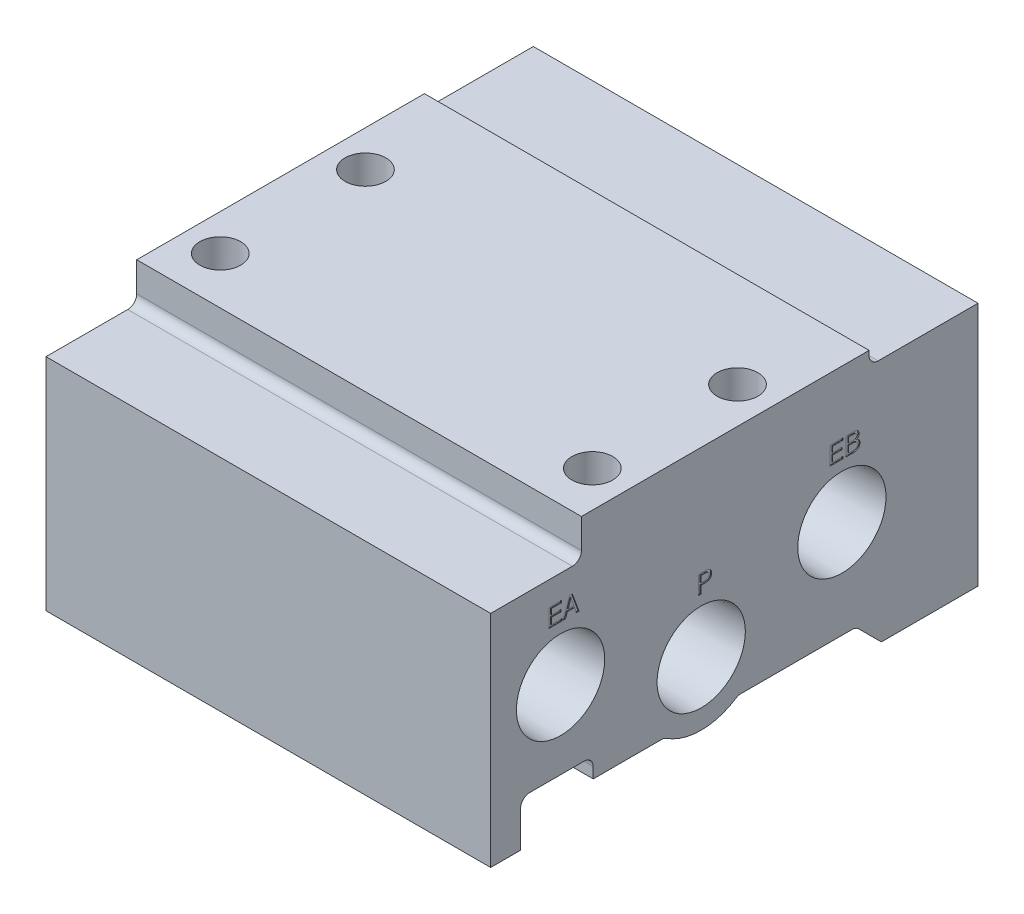
from build123d import *

# Parameters (mm, degrees)
ALUM_EXT_SKETCH_W          = 53.7
ALUM_EXT_SKETCH_H          = 28.5
ALUM_EXT_DEPTH             = 49
MGT_HOLES_SKETCH_R         = 2.25
MGT_HOLES_DEPTH            = 63.722982231
TOP_PROFILE_41_SKETCH_W    = 10
TOP_PROFILE_41_SKETCH_H    = 4.25
TOP_PROFILE_41_SKETCH_W_2  = 12
TOP_PROFILE_41_SKETCH_H_2  = 1.5
TOP_PROFILE_41_DEPTH       = 63.722982231
BOTTOM_PROFILE_41_DEPTH    = 63.722982231
ROUNDS_41_R                = 1
PORTS_AT_2_COUNT           = 2
PORTS_AT_2_PITCH           = 16.317475295
PORTS_AT_3_COUNT           = 2
PORTS_AT_3_PITCH           = 16.317475295
PORTS_MIRROR_AT_2_COUNT    = 2
PORTS_MIRROR_AT_2_PITCH    = 16.317475295
PORTS_MIRROR_AT_3_COUNT    = 2
PORTS_MIRROR_AT_3_PITCH    = 31
F_41_42_PORT_LABELS1_DEPTH = 0.1
F_41_42_PORT_LABELS2_DEPTH = 0.1
F_41_42_A_B_LABELS_DEPTH   = 0.1


with BuildPart() as part:
    # Alum Ext Sketch → Alum Ext (new body)
    with BuildSketch(Plane(origin=(0, 0, 0), x_dir=(0, 0, -1), z_dir=(1, 0, 0))):
        with Locations((0, -14.25)):
            Rectangle(ALUM_EXT_SKETCH_W, ALUM_EXT_SKETCH_H)
    extrude(amount=-ALUM_EXT_DEPTH)

    # MGT_Holes Sketch → MGT_Holes (cut, through all)
    with BuildSketch(Plane(origin=(0, 0, 0), x_dir=(1, 0, 0), z_dir=(0, 1, 0))):
        with Locations(Location((-45, 4.35, 0), (0, 0, 270))):
            Circle(MGT_HOLES_SKETCH_R)
        with Locations(Location((-45, -11.65, 0), (0, 0, 90))):
            Circle(MGT_HOLES_SKETCH_R)
        with Locations(Location((-4, 4.35, 0), (0, 0, 270))):
            Circle(MGT_HOLES_SKETCH_R)
        with Locations(Location((-4, -11.65, 0), (0, 0, 270))):
            Circle(MGT_HOLES_SKETCH_R)
    extrude(amount=-MGT_HOLES_DEPTH, mode=Mode.SUBTRACT)

    # Top_Profile_41 Sketch → Top_Profile_41 (cut, through all)
    with BuildSketch(Plane(origin=(0, 0, 0), x_dir=(0, 0, -1), z_dir=(1, 0, 0))):
        with Locations((-21.85, -2.125)):
            Rectangle(TOP_PROFILE_41_SKETCH_W, TOP_PROFILE_41_SKETCH_H)
        with Locations((20.85, -0.75)):
            Rectangle(TOP_PROFILE_41_SKETCH_W_2, TOP_PROFILE_41_SKETCH_H_2)
    extrude(amount=-TOP_PROFILE_41_DEPTH, mode=Mode.SUBTRACT)

    # Bottom_Profile_41 Sketch → Bottom_Profile_41 (cut, through all)
    with BuildSketch(Plane(origin=(0, 0, 0), x_dir=(0, 0, -1), z_dir=(1, 0, 0))):
        with BuildLine():
            Line((16.2, -28.5), (13.4, -25.7))
            Line((13.4, -25.7), (0.413249931, -25.7))
            ThreePointArc((0.413249931, -25.7), (-3.65, -27), (-7.713249931, -25.7))
            Line((-7.713249931, -25.7), (-15.55, -25.7))
            Line((-15.55, -25.7), (-15.55, -23.5))
            Line((-15.55, -23.5), (-23.55, -23.5))
            Line((-23.55, -23.5), (-23.55, -28.5))
            Line((-23.55, -28.5), (16.2, -28.5))
        make_face()
    extrude(amount=-BOTTOM_PROFILE_41_DEPTH, mode=Mode.SUBTRACT)

    # Rounds_41
    rounds_41_edges = [part.edges().sort_by_distance(p)[0] for p in [
        (-24.5, -4.25, 16.85),
        (-24.5, -1.5, -14.85),
        (-24.5, -25.7, -0.413249931),
        (-24.5, -23.5, 23.55),
        (-24.5, -23.5, 15.55),
        (-24.5, -25.7, 7.713249931),
        (-24.5, -25.7, -13.4),
    ]]
    fillet(rounds_41_edges, radius=ROUNDS_41_R)

    # Ports Profile Sketch → Ports (revolve, cut)
    with BuildSketch(Plane(origin=(0, -20, 3.65), x_dir=(0, 0, -1), z_dir=(0, 1, 0))):
        Polygon((0, 0), (0, 22.45), (3.95, 18.5), (3.95, 7.4), (4.632997004, 7.4), (4.864, 0), align=None)
    ports = revolve(axis=Axis((6.35, -20, 3.65), (-1, 0, 0)), mode=Mode.SUBTRACT)

    # Ports at 2: Ports ×2
    with Locations(*[Vector(0, 0.31254835125081226, -0.9499018518407041) * (i * PORTS_AT_2_PITCH) for i in range(1, PORTS_AT_2_COUNT)]):
        add(ports, mode=Mode.SUBTRACT)

    # Ports at 3: Ports ×2
    with Locations(*[Vector(0, 0.31254835125081226, 0.9499018518407041) * (i * PORTS_AT_3_PITCH) for i in range(1, PORTS_AT_3_COUNT)]):
        add(ports, mode=Mode.SUBTRACT)

    # Ports Mirror Profile Sketch → Ports Mirror (revolve, cut)
    with BuildSketch(Plane(origin=(-49, -14.9, -11.85), x_dir=(0, 0, 1), z_dir=(0, 1, 0))):
        Polygon((0, 0), (0, 15.885), (3.95, 11.935), (3.95, 7.4), (4.632997004, 7.4), (4.864, 0), align=None)
    ports_mirror = revolve(axis=Axis((-55.35, -14.9, -11.85), (1, 0, 0)), mode=Mode.SUBTRACT)

    # Ports Mirror at 2: Ports Mirror ×2
    with Locations(*[Vector(0, -0.31254835125081226, 0.9499018518407041) * (i * PORTS_MIRROR_AT_2_PITCH) for i in range(1, PORTS_MIRROR_AT_2_COUNT)]):
        add(ports_mirror, mode=Mode.SUBTRACT)

    # Ports Mirror at 3: Ports Mirror ×2
    with Locations(*[(0, 0, i * PORTS_MIRROR_AT_3_PITCH) for i in range(1, PORTS_MIRROR_AT_3_COUNT)]):
        add(ports_mirror, mode=Mode.SUBTRACT)

    # 41,42 Port Labels1 Sketch → 41,42 Port Labels1 (cut)
    # profile 1 of 5: a face of its own
    with BuildSketch(Plane.ZY.offset(49)):
        Polygon((-13.144871795, -8.9), (-13.144871795, -6.9), (-11.731410256, -6.9), (-11.731410256, -7.130769231), (-12.862820513, -7.130769231), (-12.862820513, -7.746153846), (-11.817948718, -7.746153846), (-11.817948718, -7.976923077), (-12.862820513, -7.976923077), (-12.862820513, -8.669230769), (-11.708974359, -8.669230769), (-11.708974359, -8.9), align=None)
    # profile 2 of 5: a face of its own
    with BuildSketch(Plane.ZY.offset(49)):
        with BuildLine():
            Line((-11.375641026, -8.9), (-11.375641026, -6.9))
            Line((-11.375641026, -6.9), (-10.582371795, -6.9))
            add(Edge.make_bspline(
                [(-10.582371795, -6.9), (-10.557520601, -6.900391088), (-10.509221677, -6.901151178), (-10.439257463, -6.906808568), (-10.373884128, -6.915794729), (-10.313491954, -6.928977632), (-10.25772712, -6.945607443), (-10.206981233, -6.966644139), (-10.160714162, -6.990826937), (-10.119486132, -7.019131964), (-10.082912178, -7.050918934), (-10.051607199, -7.087006382), (-10.024425363, -7.126312863), (-10.002795087, -7.169699096), (-9.985826511, -7.216613207), (-9.974014126, -7.267309873), (-9.966656438, -7.321659157), (-9.965816477, -7.359110147), (-9.965384615, -7.378365385)],
                knots=[0, 0, 0, 0, 1.338531614, 2.601470082, 3.778553788, 4.890456792, 5.928162005, 6.908738963, 7.84520586, 8.735147048, 9.596633689, 10.447968487, 11.301973765, 12.164180963, 13.051676454, 13.983434255, 14.963192844, 16, 16, 16, 16], degree=3))
            add(Edge.make_bspline(
                [(-9.965384615, -7.378365385), (-9.966331591, -7.402996395), (-9.968168925, -7.450785796), (-9.981718133, -7.519887959), (-10.005663085, -7.582918484), (-10.038410282, -7.640323126), (-10.080645807, -7.691469707), (-10.132507487, -7.735784439), (-10.193110711, -7.77443215), (-10.238424067, -7.793555438), (-10.261858974, -7.803445513)],
                knots=[0, 0, 0, 0, 1.064089938, 2.064560856, 3.027045975, 3.965441717, 4.908263127, 5.877849772, 6.902478258, 8, 8, 8, 8], degree=3))
            add(Edge.make_bspline(
                [(-10.261858974, -7.803445513), (-10.246569522, -7.806518626), (-10.216485798, -7.812565323), (-10.17316555, -7.826052918), (-10.132251748, -7.841956303), (-10.093880076, -7.860736947), (-10.058519403, -7.883036867), (-10.02554128, -7.907811801), (-9.995201163, -7.935720854), (-9.967752142, -7.966578157), (-9.94267115, -7.999705375), (-9.921668464, -8.035541546), (-9.903328698, -8.073092565), (-9.888526343, -8.112963113), (-9.876994446, -8.155075497), (-9.868507088, -8.199259529), (-9.863726514, -8.245513022), (-9.863126284, -8.276992465), (-9.862820513, -8.293028846)],
                knots=[0, 0, 0, 0, 1.079472139, 2.123983387, 3.137357801, 4.117691995, 5.07752268, 6.028353704, 6.970961659, 7.927265266, 8.885490285, 9.843581377, 10.799169054, 11.776706782, 12.784239396, 13.820032524, 14.889472473, 16, 16, 16, 16], degree=3))
            add(Edge.make_bspline(
                [(-9.862820513, -8.293028846), (-9.863272496, -8.315767522), (-9.864153514, -8.360090374), (-9.873541022, -8.424660596), (-9.887061044, -8.485768657), (-9.907353971, -8.543283868), (-9.933566292, -8.597000116), (-9.964872333, -8.647657469), (-10.002489133, -8.694254066), (-10.045355165, -8.737068494), (-10.093055612, -8.775646479), (-10.145401463, -8.808971319), (-10.201906819, -8.836986969), (-10.262136906, -8.860475813), (-10.326816833, -8.877901069), (-10.395416655, -8.890532564), (-10.468116052, -8.898929064), (-10.517977934, -8.899637332), (-10.543509615, -8.9)],
                knots=[0, 0, 0, 0, 1.058427598, 2.063116183, 3.033417234, 3.969927738, 4.896405358, 5.812972495, 6.737861532, 7.679194237, 8.630321786, 9.589794139, 10.563499171, 11.563941868, 12.596215416, 13.678433312, 14.811246201, 16, 16, 16, 16], degree=3))
            Line((-10.543509615, -8.9), (-11.375641026, -8.9))
        make_face()
        with BuildLine():
            Line((-11.093589744, -7.720512821), (-10.638060897, -7.720512821))
            add(Edge.make_bspline(
                [(-10.638060897, -7.720512821), (-10.62189856, -7.72024581), (-10.59060934, -7.719728896), (-10.545208349, -7.716795414), (-10.503095771, -7.710636868), (-10.464283505, -7.702711026), (-10.428663129, -7.693061693), (-10.39684222, -7.679824467), (-10.367793522, -7.665385266), (-10.342235553, -7.64779035), (-10.319629027, -7.628173795), (-10.300015633, -7.605914124), (-10.284162537, -7.580643527), (-10.270210543, -7.55333256), (-10.259923231, -7.523089629), (-10.252860224, -7.490409561), (-10.248348588, -7.45527911), (-10.247747178, -7.430997327), (-10.247435897, -7.418429487)],
                knots=[0, 0, 0, 0, 1.368886017, 2.65007316, 3.849640785, 4.969751217, 6.004381673, 6.968357812, 7.883879336, 8.746530739, 9.588092002, 10.41369514, 11.248159001, 12.107988605, 13.005734059, 13.944160956, 14.935932503, 16, 16, 16, 16], degree=3))
            add(Edge.make_bspline(
                [(-10.247435897, -7.418429487), (-10.24779526, -7.406534873), (-10.248487838, -7.383611119), (-10.252344592, -7.350275069), (-10.259615487, -7.319417291), (-10.2694704, -7.29082689), (-10.28256798, -7.264808482), (-10.298163447, -7.241021057), (-10.316774453, -7.219617856), (-10.338193209, -7.200634591), (-10.362634513, -7.184106045), (-10.389977449, -7.169577213), (-10.420615726, -7.157824898), (-10.454032304, -7.147613488), (-10.490564803, -7.140314754), (-10.529999659, -7.134572338), (-10.572575304, -7.131523238), (-10.60199904, -7.131026383), (-10.617227564, -7.130769231)],
                knots=[0, 0, 0, 0, 1.064043854, 2.05066597, 2.995108535, 3.894129092, 4.74873584, 5.593437176, 6.431611697, 7.277662936, 8.145602371, 9.064553025, 10.040417484, 11.075719197, 12.186014413, 13.368359838, 14.637970495, 16, 16, 16, 16], degree=3))
            Line((-10.617227564, -7.130769231), (-11.093589744, -7.130769231))
            Line((-11.093589744, -7.130769231), (-11.093589744, -7.720512821))
        make_face(mode=Mode.SUBTRACT)
        with BuildLine():
            Line((-11.093589744, -8.669230769), (-10.566746795, -8.669230769))
            add(Edge.make_bspline(
                [(-10.566746795, -8.669230769), (-10.549908372, -8.668922161), (-10.517373227, -8.668325869), (-10.470137599, -8.663774034), (-10.425994956, -8.656854934), (-10.385013028, -8.64634983), (-10.346971081, -8.633180858), (-10.312127837, -8.616877954), (-10.280547117, -8.597345386), (-10.251784041, -8.575352814), (-10.226609275, -8.550046268), (-10.204679995, -8.522071895), (-10.186188284, -8.49137213), (-10.170917321, -8.458069746), (-10.159316799, -8.421991925), (-10.151012013, -8.383343954), (-10.145625468, -8.342058175), (-10.145127121, -8.313612472), (-10.144871795, -8.299038462)],
                knots=[0, 0, 0, 0, 1.261340787, 2.437158505, 3.552412744, 4.605618057, 5.602418951, 6.564726798, 7.481099983, 8.379712099, 9.271165627, 10.147841252, 11.036708081, 11.950072001, 12.886651798, 13.869902527, 14.90865543, 16, 16, 16, 16], degree=3))
            add(Edge.make_bspline(
                [(-10.144871795, -8.299038462), (-10.145117446, -8.284595974), (-10.145594563, -8.256544995), (-10.151054338, -8.215943132), (-10.159140342, -8.17810658), (-10.171288059, -8.143473319), (-10.18652651, -8.111724261), (-10.205588286, -8.083183638), (-10.227647172, -8.057184402), (-10.253710324, -8.034583368), (-10.28331899, -8.01494812), (-10.31638283, -7.997503895), (-10.353598, -7.98333953), (-10.394496601, -7.971081379), (-10.439692519, -7.962804431), (-10.488439021, -7.955798704), (-10.541174333, -7.951838231), (-10.577557944, -7.951471772), (-10.596394231, -7.951282051)],
                knots=[0, 0, 0, 0, 1.058252033, 2.055394168, 2.998523969, 3.890395008, 4.739981298, 5.573732922, 6.40003374, 7.23274972, 8.093659094, 9.000297479, 9.967667442, 11.00874663, 12.12639854, 13.332554366, 14.619027337, 16, 16, 16, 16], degree=3))
            Line((-10.596394231, -7.951282051), (-11.093589744, -7.951282051))
            Line((-11.093589744, -7.951282051), (-11.093589744, -8.669230769))
        make_face(mode=Mode.SUBTRACT)
    # profile 3 of 5: a face of its own
    with BuildSketch(Plane.ZY.offset(49)):
        with BuildLine():
            Line((3.355128205, -14), (3.355128205, -12))
            Line((3.355128205, -12), (4.095913462, -12))
            add(Edge.make_bspline(
                [(4.095913462, -12), (4.12409362, -12.000249378), (4.177002091, -12.000717587), (4.250934098, -12.003608091), (4.314154858, -12.009200397), (4.368073681, -12.016451865), (4.415166702, -12.02754219), (4.458606554, -12.040013914), (4.499344903, -12.056098279), (4.524832794, -12.069234093), (4.537419872, -12.075721154)],
                knots=[0, 0, 0, 0, 1.493455121, 2.803973871, 3.919514338, 4.856337602, 5.683863995, 6.481055044, 7.249876038, 8, 8, 8, 8], degree=3))
            add(Edge.make_bspline(
                [(4.537419872, -12.075721154), (4.557109161, -12.087505308), (4.596238242, -12.110924292), (4.646867088, -12.157428597), (4.691435381, -12.210646113), (4.726929673, -12.2725773), (4.756116688, -12.340350372), (4.776198097, -12.414407034), (4.789029685, -12.493809121), (4.790347685, -12.548692188), (4.791025641, -12.576923077)],
                knots=[0, 0, 0, 0, 0.930560885, 1.849329941, 2.778623248, 3.742228717, 4.739438803, 5.770715934, 6.853295292, 8, 8, 8, 8], degree=3))
            add(Edge.make_bspline(
                [(4.791025641, -12.576923077), (4.790347059, -12.603953612), (4.78902587, -12.65658169), (4.776100386, -12.733053307), (4.755916476, -12.804708226), (4.727367087, -12.871331941), (4.690898401, -12.932063622), (4.64652939, -12.986531524), (4.594678687, -13.034755885), (4.555051994, -13.060899771), (4.535016026, -13.07411859)],
                knots=[0, 0, 0, 0, 1.106237948, 2.15382993, 3.166616047, 4.14912887, 5.113446575, 6.058253874, 7.018218259, 8, 8, 8, 8], degree=3))
            add(Edge.make_bspline(
                [(4.535016026, -13.07411859), (4.522597077, -13.081071894), (4.497311506, -13.095229151), (4.456117103, -13.111618603), (4.412179284, -13.125952788), (4.372704814, -13.134789239), (4.337996409, -13.140616309), (4.307779075, -13.144194947), (4.273668896, -13.146691653), (4.235640761, -13.149761537), (4.193551564, -13.151643471), (4.147467197, -13.152726574), (4.097518693, -13.153554018), (4.06292769, -13.153746548), (4.045032051, -13.153846154)],
                knots=[0, 0, 0, 0, 1.018466528, 2.073646265, 3.168741587, 4.32666575, 4.966710573, 5.68928523, 6.505122404, 7.416327688, 8.421864515, 9.522294478, 10.718160255, 12, 12, 12, 12], degree=3))
            Line((4.045032051, -13.153846154), (3.637179487, -13.153846154))
            Line((3.637179487, -13.153846154), (3.637179487, -14))
            Line((3.637179487, -14), (3.355128205, -14))
        make_face()
        with BuildLine():
            Line((3.637179487, -12.923076923), (4.087900641, -12.923076923))
            add(Edge.make_bspline(
                [(4.087900641, -12.923076923), (4.106734424, -12.922848085), (4.142970313, -12.922407806), (4.195182234, -12.919020543), (4.2428652, -12.912380011), (4.286306282, -12.90452837), (4.324991337, -12.892914993), (4.359724875, -12.880257808), (4.389709515, -12.863882812), (4.415997913, -12.84536947), (4.43829063, -12.823331396), (4.457379289, -12.798065143), (4.473409826, -12.769311124), (4.486624477, -12.737183964), (4.496532941, -12.70151272), (4.503634352, -12.662491291), (4.508057153, -12.619891899), (4.508660905, -12.590288992), (4.508974359, -12.574919872)],
                knots=[0, 0, 0, 0, 1.418142734, 2.728483292, 3.935852239, 5.042182902, 6.047730313, 6.973980857, 7.819836916, 8.612371598, 9.387426252, 10.169752478, 10.989196503, 11.859387264, 12.779284547, 13.771317079, 14.842921177, 16, 16, 16, 16], degree=3))
            add(Edge.make_bspline(
                [(4.508974359, -12.574919872), (4.508621001, -12.560087188), (4.507941592, -12.531568007), (4.504041052, -12.490281163), (4.497103925, -12.452223938), (4.486320171, -12.417522781), (4.473955018, -12.385611284), (4.457636989, -12.357322195), (4.43872536, -12.332221086), (4.416721841, -12.31008833), (4.391039013, -12.291246478), (4.361972539, -12.274585285), (4.328843401, -12.261233914), (4.292121529, -12.249962633), (4.251491521, -12.241304691), (4.207065619, -12.234912843), (4.15873708, -12.23141909), (4.125299202, -12.230991373), (4.107932692, -12.230769231)],
                knots=[0, 0, 0, 0, 1.160442503, 2.231212519, 3.241398704, 4.180061104, 5.070566702, 5.91288362, 6.725721963, 7.523583634, 8.344772017, 9.210415603, 10.137847341, 11.13257169, 12.212527806, 13.384203378, 14.64144318, 16, 16, 16, 16], degree=3))
            Line((4.107932692, -12.230769231), (3.637179487, -12.230769231))
            Line((3.637179487, -12.230769231), (3.637179487, -12.923076923))
        make_face(mode=Mode.SUBTRACT)
    # profile 4 of 5: a face of its own
    with BuildSketch(Plane.ZY.offset(49)):
        Polygon((17.855128205, -8.9), (17.855128205, -6.9), (19.268589744, -6.9), (19.268589744, -7.130769231), (18.137179487, -7.130769231), (18.137179487, -7.746153846), (19.182051282, -7.746153846), (19.182051282, -7.976923077), (18.137179487, -7.976923077), (18.137179487, -8.669230769), (19.291025641, -8.669230769), (19.291025641, -8.9), align=None)
    # profile 5 of 5: a face of its own
    with BuildSketch(Plane.ZY.offset(49)):
        Polygon((19.419230769, -8.9), (20.149198718, -6.9), (20.447676282, -6.9), (21.188461538, -8.9), (20.895592949, -8.9), (20.68525641, -8.31025641), (19.902403846, -8.31025641), (19.690464744, -8.9), align=None)
        Polygon((19.986137821, -8.079487179), (20.605528846, -8.079487179), (20.297836538, -7.188862179), align=None, mode=Mode.SUBTRACT)
    extrude(amount=-F_41_42_PORT_LABELS1_DEPTH, mode=Mode.SUBTRACT)

    # 41,42 Port Labels2 Sketch → 41,42 Port Labels2 (cut)
    # profile 1 of 5: a face of its own
    with BuildSketch(Plane(origin=(0, 0, 0), x_dir=(0, 0, -1), z_dir=(1, 0, 0))):
        Polygon((-20.444871795, -8.9), (-20.444871795, -6.9), (-19.031410256, -6.9), (-19.031410256, -7.130769231), (-20.162820513, -7.130769231), (-20.162820513, -7.746153846), (-19.117948718, -7.746153846), (-19.117948718, -7.976923077), (-20.162820513, -7.976923077), (-20.162820513, -8.669230769), (-19.008974359, -8.669230769), (-19.008974359, -8.9), align=None)
    # profile 2 of 5: a face of its own
    with BuildSketch(Plane(origin=(0, 0, 0), x_dir=(0, 0, -1), z_dir=(1, 0, 0))):
        Polygon((-18.880769231, -8.9), (-18.150801282, -6.9), (-17.852323718, -6.9), (-17.111538462, -8.9), (-17.404407051, -8.9), (-17.61474359, -8.31025641), (-18.397596154, -8.31025641), (-18.609535256, -8.9), align=None)
        Polygon((-18.313862179, -8.079487179), (-17.694471154, -8.079487179), (-18.002163462, -7.188862179), align=None, mode=Mode.SUBTRACT)
    # profile 3 of 5: a face of its own
    with BuildSketch(Plane(origin=(0, 0, 0), x_dir=(0, 0, -1), z_dir=(1, 0, 0))):
        with BuildLine():
            Line((-3.944871795, -14), (-3.944871795, -12))
            Line((-3.944871795, -12), (-3.204086538, -12))
            add(Edge.make_bspline(
                [(-3.204086538, -12), (-3.17590638, -12.000249378), (-3.122997909, -12.000717587), (-3.049065902, -12.003608091), (-2.985845142, -12.009200397), (-2.931926319, -12.016451865), (-2.884833298, -12.02754219), (-2.841393446, -12.040013914), (-2.800655097, -12.056098279), (-2.775167206, -12.069234093), (-2.762580128, -12.075721154)],
                knots=[0, 0, 0, 0, 1.493455121, 2.803973871, 3.919514338, 4.856337602, 5.683863995, 6.481055044, 7.249876038, 8, 8, 8, 8], degree=3))
            add(Edge.make_bspline(
                [(-2.762580128, -12.075721154), (-2.742890839, -12.087505308), (-2.703761758, -12.110924292), (-2.653132912, -12.157428597), (-2.608564619, -12.210646113), (-2.573070327, -12.2725773), (-2.543883312, -12.340350372), (-2.523801903, -12.414407034), (-2.510970315, -12.493809121), (-2.509652315, -12.548692188), (-2.508974359, -12.576923077)],
                knots=[0, 0, 0, 0, 0.930560885, 1.849329941, 2.778623248, 3.742228717, 4.739438803, 5.770715934, 6.853295292, 8, 8, 8, 8], degree=3))
            add(Edge.make_bspline(
                [(-2.508974359, -12.576923077), (-2.509652941, -12.603953612), (-2.51097413, -12.65658169), (-2.523899614, -12.733053307), (-2.544083524, -12.804708226), (-2.572632913, -12.871331941), (-2.609101599, -12.932063622), (-2.65347061, -12.986531524), (-2.705321313, -13.034755885), (-2.744948006, -13.060899771), (-2.764983974, -13.07411859)],
                knots=[0, 0, 0, 0, 1.106237948, 2.15382993, 3.166616047, 4.14912887, 5.113446575, 6.058253874, 7.018218259, 8, 8, 8, 8], degree=3))
            add(Edge.make_bspline(
                [(-2.764983974, -13.07411859), (-2.777402923, -13.081071894), (-2.802688494, -13.095229151), (-2.843882897, -13.111618603), (-2.887820716, -13.125952788), (-2.927295186, -13.134789239), (-2.962003591, -13.140616309), (-2.992220925, -13.144194947), (-3.026331104, -13.146691653), (-3.064359239, -13.149761537), (-3.106448436, -13.151643471), (-3.152532803, -13.152726574), (-3.202481307, -13.153554018), (-3.23707231, -13.153746548), (-3.254967949, -13.153846154)],
                knots=[0, 0, 0, 0, 1.018466528, 2.073646265, 3.168741587, 4.32666575, 4.966710573, 5.68928523, 6.505122404, 7.416327688, 8.421864515, 9.522294478, 10.718160255, 12, 12, 12, 12], degree=3))
            Line((-3.254967949, -13.153846154), (-3.662820513, -13.153846154))
            Line((-3.662820513, -13.153846154), (-3.662820513, -14))
            Line((-3.662820513, -14), (-3.944871795, -14))
        make_face()
        with BuildLine():
            Line((-3.662820513, -12.923076923), (-3.212099359, -12.923076923))
            add(Edge.make_bspline(
                [(-3.212099359, -12.923076923), (-3.193265576, -12.922848085), (-3.157029687, -12.922407806), (-3.104817766, -12.919020543), (-3.0571348, -12.912380011), (-3.013693718, -12.90452837), (-2.975008663, -12.892914993), (-2.940275125, -12.880257808), (-2.910290485, -12.863882812), (-2.884002087, -12.84536947), (-2.86170937, -12.823331396), (-2.842620711, -12.798065143), (-2.826590174, -12.769311124), (-2.813375523, -12.737183964), (-2.803467059, -12.70151272), (-2.796365648, -12.662491291), (-2.791942847, -12.619891899), (-2.791339095, -12.590288992), (-2.791025641, -12.574919872)],
                knots=[0, 0, 0, 0, 1.418142734, 2.728483292, 3.935852239, 5.042182902, 6.047730313, 6.973980857, 7.819836916, 8.612371598, 9.387426252, 10.169752478, 10.989196503, 11.859387264, 12.779284547, 13.771317079, 14.842921177, 16, 16, 16, 16], degree=3))
            add(Edge.make_bspline(
                [(-2.791025641, -12.574919872), (-2.791378999, -12.560087188), (-2.792058408, -12.531568007), (-2.795958948, -12.490281163), (-2.802896075, -12.452223938), (-2.813679829, -12.417522781), (-2.826044982, -12.385611284), (-2.842363011, -12.357322195), (-2.86127464, -12.332221086), (-2.883278159, -12.31008833), (-2.908960987, -12.291246478), (-2.938027461, -12.274585285), (-2.971156599, -12.261233914), (-3.007878471, -12.249962633), (-3.048508479, -12.241304691), (-3.092934381, -12.234912843), (-3.14126292, -12.23141909), (-3.174700798, -12.230991373), (-3.192067308, -12.230769231)],
                knots=[0, 0, 0, 0, 1.160442503, 2.231212519, 3.241398704, 4.180061104, 5.070566702, 5.91288362, 6.725721963, 7.523583634, 8.344772017, 9.210415603, 10.137847341, 11.13257169, 12.212527806, 13.384203378, 14.64144318, 16, 16, 16, 16], degree=3))
            Line((-3.192067308, -12.230769231), (-3.662820513, -12.230769231))
            Line((-3.662820513, -12.230769231), (-3.662820513, -12.923076923))
        make_face(mode=Mode.SUBTRACT)
    # profile 4 of 5: a face of its own
    with BuildSketch(Plane(origin=(0, 0, 0), x_dir=(0, 0, -1), z_dir=(1, 0, 0))):
        Polygon((10.555128205, -8.9), (10.555128205, -6.9), (11.968589744, -6.9), (11.968589744, -7.130769231), (10.837179487, -7.130769231), (10.837179487, -7.746153846), (11.882051282, -7.746153846), (11.882051282, -7.976923077), (10.837179487, -7.976923077), (10.837179487, -8.669230769), (11.991025641, -8.669230769), (11.991025641, -8.9), align=None)
    # profile 5 of 5: a face of its own
    with BuildSketch(Plane(origin=(0, 0, 0), x_dir=(0, 0, -1), z_dir=(1, 0, 0))):
        with BuildLine():
            Line((12.324358974, -8.9), (12.324358974, -6.9))
            Line((12.324358974, -6.9), (13.117628205, -6.9))
            add(Edge.make_bspline(
                [(13.117628205, -6.9), (13.142479399, -6.900391088), (13.190778323, -6.901151178), (13.260742537, -6.906808568), (13.326115872, -6.915794729), (13.386508046, -6.928977632), (13.44227288, -6.945607443), (13.493018767, -6.966644139), (13.539285838, -6.990826937), (13.580513868, -7.019131964), (13.617087822, -7.050918934), (13.648392801, -7.087006382), (13.675574637, -7.126312863), (13.697204913, -7.169699096), (13.714173489, -7.216613207), (13.725985874, -7.267309873), (13.733343562, -7.321659157), (13.734183523, -7.359110147), (13.734615385, -7.378365385)],
                knots=[0, 0, 0, 0, 1.338531614, 2.601470082, 3.778553788, 4.890456792, 5.928162005, 6.908738963, 7.84520586, 8.735147048, 9.596633689, 10.447968487, 11.301973765, 12.164180963, 13.051676454, 13.983434255, 14.963192844, 16, 16, 16, 16], degree=3))
            add(Edge.make_bspline(
                [(13.734615385, -7.378365385), (13.733668409, -7.402996395), (13.731831075, -7.450785796), (13.718281867, -7.519887959), (13.694336915, -7.582918484), (13.661589718, -7.640323126), (13.619354193, -7.691469707), (13.567492513, -7.735784439), (13.506889289, -7.77443215), (13.461575933, -7.793555438), (13.438141026, -7.803445513)],
                knots=[0, 0, 0, 0, 1.064089938, 2.064560856, 3.027045975, 3.965441717, 4.908263127, 5.877849772, 6.902478258, 8, 8, 8, 8], degree=3))
            add(Edge.make_bspline(
                [(13.438141026, -7.803445513), (13.453430478, -7.806518626), (13.483514202, -7.812565323), (13.52683445, -7.826052918), (13.567748252, -7.841956303), (13.606119924, -7.860736947), (13.641480597, -7.883036867), (13.67445872, -7.907811801), (13.704798837, -7.935720854), (13.732247858, -7.966578157), (13.75732885, -7.999705375), (13.778331536, -8.035541546), (13.796671302, -8.073092565), (13.811473657, -8.112963113), (13.823005554, -8.155075497), (13.831492912, -8.199259529), (13.836273486, -8.245513022), (13.836873716, -8.276992465), (13.837179487, -8.293028846)],
                knots=[0, 0, 0, 0, 1.079472139, 2.123983387, 3.137357801, 4.117691995, 5.07752268, 6.028353704, 6.970961659, 7.927265266, 8.885490285, 9.843581377, 10.799169054, 11.776706782, 12.784239396, 13.820032524, 14.889472473, 16, 16, 16, 16], degree=3))
            add(Edge.make_bspline(
                [(13.837179487, -8.293028846), (13.836727504, -8.315767522), (13.835846486, -8.360090374), (13.826458978, -8.424660596), (13.812938956, -8.485768657), (13.792646029, -8.543283868), (13.766433708, -8.597000116), (13.735127667, -8.647657469), (13.697510867, -8.694254066), (13.654644835, -8.737068494), (13.606944388, -8.775646479), (13.554598537, -8.808971319), (13.498093181, -8.836986969), (13.437863094, -8.860475813), (13.373183167, -8.877901069), (13.304583345, -8.890532564), (13.231883948, -8.898929064), (13.182022066, -8.899637332), (13.156490385, -8.9)],
                knots=[0, 0, 0, 0, 1.058427598, 2.063116183, 3.033417234, 3.969927738, 4.896405358, 5.812972495, 6.737861532, 7.679194237, 8.630321786, 9.589794139, 10.563499171, 11.563941868, 12.596215416, 13.678433312, 14.811246201, 16, 16, 16, 16], degree=3))
            Line((13.156490385, -8.9), (12.324358974, -8.9))
        make_face()
        with BuildLine():
            Line((12.606410256, -7.720512821), (13.061939103, -7.720512821))
            add(Edge.make_bspline(
                [(13.061939103, -7.720512821), (13.07810144, -7.72024581), (13.10939066, -7.719728896), (13.154791651, -7.716795414), (13.196904229, -7.710636868), (13.235716495, -7.702711026), (13.271336871, -7.693061693), (13.30315778, -7.679824467), (13.332206478, -7.665385266), (13.357764447, -7.64779035), (13.380370973, -7.628173795), (13.399984367, -7.605914124), (13.415837463, -7.580643527), (13.429789457, -7.55333256), (13.440076769, -7.523089629), (13.447139776, -7.490409561), (13.451651412, -7.45527911), (13.452252822, -7.430997327), (13.452564103, -7.418429487)],
                knots=[0, 0, 0, 0, 1.368886017, 2.65007316, 3.849640785, 4.969751217, 6.004381673, 6.968357812, 7.883879336, 8.746530739, 9.588092002, 10.41369514, 11.248159001, 12.107988605, 13.005734059, 13.944160956, 14.935932503, 16, 16, 16, 16], degree=3))
            add(Edge.make_bspline(
                [(13.452564103, -7.418429487), (13.45220474, -7.406534873), (13.451512162, -7.383611119), (13.447655408, -7.350275069), (13.440384513, -7.319417291), (13.4305296, -7.29082689), (13.41743202, -7.264808482), (13.401836553, -7.241021057), (13.383225547, -7.219617856), (13.361806791, -7.200634591), (13.337365487, -7.184106045), (13.310022551, -7.169577213), (13.279384274, -7.157824898), (13.245967696, -7.147613488), (13.209435197, -7.140314754), (13.170000341, -7.134572338), (13.127424696, -7.131523238), (13.09800096, -7.131026383), (13.082772436, -7.130769231)],
                knots=[0, 0, 0, 0, 1.064043854, 2.05066597, 2.995108535, 3.894129092, 4.74873584, 5.593437176, 6.431611697, 7.277662936, 8.145602371, 9.064553025, 10.040417484, 11.075719197, 12.186014413, 13.368359838, 14.637970495, 16, 16, 16, 16], degree=3))
            Line((13.082772436, -7.130769231), (12.606410256, -7.130769231))
            Line((12.606410256, -7.130769231), (12.606410256, -7.720512821))
        make_face(mode=Mode.SUBTRACT)
        with BuildLine():
            Line((12.606410256, -8.669230769), (13.133253205, -8.669230769))
            add(Edge.make_bspline(
                [(13.133253205, -8.669230769), (13.150091628, -8.668922161), (13.182626773, -8.668325869), (13.229862401, -8.663774034), (13.274005044, -8.656854934), (13.314986972, -8.64634983), (13.353028919, -8.633180858), (13.387872163, -8.616877954), (13.419452883, -8.597345386), (13.448215959, -8.575352814), (13.473390725, -8.550046268), (13.495320005, -8.522071895), (13.513811716, -8.49137213), (13.529082679, -8.458069746), (13.540683201, -8.421991925), (13.548987987, -8.383343954), (13.554374532, -8.342058175), (13.554872879, -8.313612472), (13.555128205, -8.299038462)],
                knots=[0, 0, 0, 0, 1.261340787, 2.437158505, 3.552412744, 4.605618057, 5.602418951, 6.564726798, 7.481099983, 8.379712099, 9.271165627, 10.147841252, 11.036708081, 11.950072001, 12.886651798, 13.869902527, 14.90865543, 16, 16, 16, 16], degree=3))
            add(Edge.make_bspline(
                [(13.555128205, -8.299038462), (13.554882554, -8.284595974), (13.554405437, -8.256544995), (13.548945662, -8.215943132), (13.540859658, -8.17810658), (13.528711941, -8.143473319), (13.51347349, -8.111724261), (13.494411714, -8.083183638), (13.472352828, -8.057184402), (13.446289676, -8.034583368), (13.41668101, -8.01494812), (13.38361717, -7.997503895), (13.346402, -7.98333953), (13.305503399, -7.971081379), (13.260307481, -7.962804431), (13.211560979, -7.955798704), (13.158825667, -7.951838231), (13.122442056, -7.951471772), (13.103605769, -7.951282051)],
                knots=[0, 0, 0, 0, 1.058252033, 2.055394168, 2.998523969, 3.890395008, 4.739981298, 5.573732922, 6.40003374, 7.23274972, 8.093659094, 9.000297479, 9.967667442, 11.00874663, 12.12639854, 13.332554366, 14.619027337, 16, 16, 16, 16], degree=3))
            Line((13.103605769, -7.951282051), (12.606410256, -7.951282051))
            Line((12.606410256, -7.951282051), (12.606410256, -8.669230769))
        make_face(mode=Mode.SUBTRACT)
    extrude(amount=-F_41_42_PORT_LABELS2_DEPTH, mode=Mode.SUBTRACT)

    # 41,42 A,B Labels Sketch → 41,42 A,B Labels (cut)
    # profile 1 of 4: a face of its own
    with BuildSketch(Plane.XY.offset(-26.85)):
        Polygon((-44.5, -10), (-45.77744391, -6.5), (-46.299779647, -6.5), (-47.596153846, -10), (-47.083633814, -10), (-46.715544872, -8.967948718), (-45.345552885, -8.967948718), (-44.974659455, -10), align=None)
        Polygon((-45.49208734, -8.564102564), (-46.576021635, -8.564102564), (-46.037560096, -7.005508814), align=None, mode=Mode.SUBTRACT)
    # profile 2 of 4: a face of its own
    with BuildSketch(Plane.XY.offset(-26.85)):
        with BuildLine():
            Line((-38.358974359, -23.5), (-38.358974359, -20))
            Line((-38.358974359, -20), (-39.747195513, -20))
            add(Edge.make_bspline(
                [(-39.747195513, -20), (-39.790685102, -20.000684404), (-39.875208219, -20.002014561), (-39.997645593, -20.011914994), (-40.11204893, -20.027640776), (-40.217735234, -20.050710856), (-40.315323694, -20.079813026), (-40.404128997, -20.116627242), (-40.485096371, -20.158947141), (-40.557245422, -20.208480936), (-40.621249843, -20.264108134), (-40.676033556, -20.327261168), (-40.723601769, -20.396047509), (-40.761454752, -20.471973419), (-40.79114976, -20.554073113), (-40.811821433, -20.642792277), (-40.824697388, -20.737903525), (-40.826167319, -20.803442756), (-40.826923077, -20.837139423)],
                knots=[0, 0, 0, 0, 1.338531614, 2.601470082, 3.778553788, 4.890456792, 5.928162005, 6.908738963, 7.84520586, 8.735147048, 9.596633689, 10.447968487, 11.301973765, 12.164180963, 13.051676454, 13.983434255, 14.963192844, 16, 16, 16, 16], degree=3))
            add(Edge.make_bspline(
                [(-40.826923077, -20.837139423), (-40.82526587, -20.880243692), (-40.822050535, -20.963875144), (-40.79833942, -21.084803928), (-40.756435755, -21.195107347), (-40.699128161, -21.295565471), (-40.625215992, -21.385071987), (-40.534458052, -21.462622768), (-40.428402409, -21.530256263), (-40.349104036, -21.563722017), (-40.308092949, -21.581029647)],
                knots=[0, 0, 0, 0, 1.064089938, 2.064560856, 3.027045975, 3.965441717, 4.908263127, 5.877849772, 6.902478258, 8, 8, 8, 8], degree=3))
            add(Edge.make_bspline(
                [(-40.308092949, -21.581029647), (-40.33484949, -21.586407596), (-40.387496008, -21.596989316), (-40.463306442, -21.620592607), (-40.534905595, -21.648423531), (-40.602056021, -21.681289657), (-40.663937199, -21.720314518), (-40.721648914, -21.763670652), (-40.774744119, -21.812511494), (-40.822779905, -21.866511775), (-40.866671641, -21.924484406), (-40.903426342, -21.987197706), (-40.935520932, -22.052911989), (-40.961425053, -22.122685447), (-40.981605873, -22.196382119), (-40.99645875, -22.273704176), (-41.004824755, -22.354647789), (-41.005875157, -22.409736815), (-41.006410256, -22.437800481)],
                knots=[0, 0, 0, 0, 1.079472139, 2.123983387, 3.137357801, 4.117691995, 5.07752268, 6.028353704, 6.970961659, 7.927265266, 8.885490285, 9.843581377, 10.799169054, 11.776706782, 12.784239396, 13.820032524, 14.889472473, 16, 16, 16, 16], degree=3))
            add(Edge.make_bspline(
                [(-41.006410256, -22.437800481), (-41.005619286, -22.477593164), (-41.004077505, -22.555158155), (-40.987649365, -22.668156042), (-40.963989327, -22.77509515), (-40.928476704, -22.875746769), (-40.882605143, -22.969750203), (-40.827819571, -23.058400571), (-40.761990171, -23.139944616), (-40.686974614, -23.214869865), (-40.603498834, -23.282381338), (-40.511893594, -23.340699808), (-40.41300922, -23.389727196), (-40.307606568, -23.430832673), (-40.194416695, -23.461326871), (-40.074367008, -23.483431987), (-39.947143063, -23.498125862), (-39.85988477, -23.499365332), (-39.815204327, -23.5)],
                knots=[0, 0, 0, 0, 1.058427598, 2.063116183, 3.033417234, 3.969927738, 4.896405358, 5.812972495, 6.737861532, 7.679194237, 8.630321786, 9.589794139, 10.563499171, 11.563941868, 12.596215416, 13.678433312, 14.811246201, 16, 16, 16, 16], degree=3))
            Line((-39.815204327, -23.5), (-38.358974359, -23.5))
        make_face()
        with BuildLine():
            Line((-38.852564103, -21.435897436), (-39.649739583, -21.435897436))
            add(Edge.make_bspline(
                [(-39.649739583, -21.435897436), (-39.678023674, -21.435430168), (-39.73277981, -21.434525568), (-39.812231542, -21.429391974), (-39.885928555, -21.418614519), (-39.953850021, -21.404744295), (-40.016185678, -21.387857963), (-40.071872268, -21.364692817), (-40.12270749, -21.339424215), (-40.167433937, -21.308633112), (-40.206995357, -21.274304141), (-40.241318795, -21.235349716), (-40.269061713, -21.191126172), (-40.293477703, -21.143331981), (-40.3114805, -21.09040685), (-40.323840762, -21.033216732), (-40.331736124, -20.971738443), (-40.332788593, -20.929245323), (-40.333333333, -20.907251603)],
                knots=[0, 0, 0, 0, 1.368886017, 2.65007316, 3.849640785, 4.969751217, 6.004381673, 6.968357812, 7.883879336, 8.746530739, 9.588092002, 10.41369514, 11.248159001, 12.107988605, 13.005734059, 13.944160956, 14.935932503, 16, 16, 16, 16], degree=3))
            add(Edge.make_bspline(
                [(-40.333333333, -20.907251603), (-40.332704448, -20.886436029), (-40.331492437, -20.846319459), (-40.324743118, -20.78798137), (-40.312019051, -20.733980259), (-40.294772954, -20.683947058), (-40.271852189, -20.638414843), (-40.244560122, -20.59678685), (-40.211990861, -20.559331249), (-40.174508037, -20.526110534), (-40.131735756, -20.497185578), (-40.083885618, -20.471760122), (-40.030268633, -20.451193571), (-39.971789621, -20.433323604), (-39.907857749, -20.42055082), (-39.83884675, -20.410501592), (-39.764339373, -20.405165666), (-39.712847835, -20.40429617), (-39.686197917, -20.403846154)],
                knots=[0, 0, 0, 0, 1.064043854, 2.05066597, 2.995108535, 3.894129092, 4.74873584, 5.593437176, 6.431611697, 7.277662936, 8.145602371, 9.064553025, 10.040417484, 11.075719197, 12.186014413, 13.368359838, 14.637970495, 16, 16, 16, 16], degree=3))
            Line((-39.686197917, -20.403846154), (-38.852564103, -20.403846154))
            Line((-38.852564103, -20.403846154), (-38.852564103, -21.435897436))
        make_face(mode=Mode.SUBTRACT)
        with BuildLine():
            Line((-38.852564103, -23.096153846), (-39.774539263, -23.096153846))
            add(Edge.make_bspline(
                [(-39.774539263, -23.096153846), (-39.804006503, -23.095613782), (-39.860943007, -23.094570271), (-39.943605356, -23.086604559), (-40.020854981, -23.074496135), (-40.092573355, -23.056112202), (-40.159146761, -23.033066501), (-40.220122439, -23.004536419), (-40.275388699, -22.970354426), (-40.325724082, -22.931867424), (-40.369779923, -22.88758097), (-40.408156162, -22.838625817), (-40.440516657, -22.784901228), (-40.467240842, -22.726622055), (-40.487541756, -22.663485868), (-40.502075131, -22.595851919), (-40.511501585, -22.523601806), (-40.512373693, -22.473821826), (-40.512820513, -22.448317308)],
                knots=[0, 0, 0, 0, 1.261340787, 2.437158505, 3.552412744, 4.605618057, 5.602418951, 6.564726798, 7.481099983, 8.379712099, 9.271165627, 10.147841252, 11.036708081, 11.950072001, 12.886651798, 13.869902527, 14.90865543, 16, 16, 16, 16], degree=3))
            add(Edge.make_bspline(
                [(-40.512820513, -22.448317308), (-40.512390624, -22.423042954), (-40.511555669, -22.373953741), (-40.502001063, -22.30290048), (-40.487850556, -22.236686515), (-40.466592051, -22.176078308), (-40.439924762, -22.120517457), (-40.406566653, -22.070571367), (-40.367963603, -22.025072704), (-40.322353087, -21.985520894), (-40.270537921, -21.95115921), (-40.212676202, -21.920631816), (-40.147549654, -21.895844178), (-40.075977103, -21.874392413), (-39.996884246, -21.859907754), (-39.911577868, -21.847647732), (-39.819291071, -21.840716904), (-39.755619752, -21.840075601), (-39.72265625, -21.83974359)],
                knots=[0, 0, 0, 0, 1.058252033, 2.055394168, 2.998523969, 3.890395008, 4.739981298, 5.573732922, 6.40003374, 7.23274972, 8.093659094, 9.000297479, 9.967667442, 11.00874663, 12.12639854, 13.332554366, 14.619027337, 16, 16, 16, 16], degree=3))
            Line((-39.72265625, -21.83974359), (-38.852564103, -21.83974359))
            Line((-38.852564103, -21.83974359), (-38.852564103, -23.096153846))
        make_face(mode=Mode.SUBTRACT)
    # profile 3 of 4: a face of its own
    with BuildSketch(Plane.XY.offset(-26.85)):
        Polygon((-8, -10), (-9.27744391, -6.5), (-9.799779647, -6.5), (-11.096153846, -10), (-10.583633814, -10), (-10.215544872, -8.967948718), (-8.845552885, -8.967948718), (-8.474659455, -10), align=None)
        Polygon((-8.99208734, -8.564102564), (-10.076021635, -8.564102564), (-9.537560096, -7.005508814), align=None, mode=Mode.SUBTRACT)
    # profile 4 of 4: a face of its own
    with BuildSketch(Plane.XY.offset(-26.85)):
        with BuildLine():
            Line((-1.358974359, -23.5), (-1.358974359, -20))
            Line((-1.358974359, -20), (-2.747195513, -20))
            add(Edge.make_bspline(
                [(-2.747195513, -20), (-2.790685102, -20.000684404), (-2.875208219, -20.002014561), (-2.997645593, -20.011914994), (-3.11204893, -20.027640776), (-3.217735234, -20.050710856), (-3.315323694, -20.079813026), (-3.404128997, -20.116627242), (-3.485096371, -20.158947141), (-3.557245422, -20.208480936), (-3.621249843, -20.264108134), (-3.676033556, -20.327261168), (-3.723601769, -20.396047509), (-3.761454752, -20.471973419), (-3.79114976, -20.554073113), (-3.811821433, -20.642792277), (-3.824697388, -20.737903525), (-3.826167319, -20.803442756), (-3.826923077, -20.837139423)],
                knots=[0, 0, 0, 0, 1.338531614, 2.601470082, 3.778553788, 4.890456792, 5.928162005, 6.908738963, 7.84520586, 8.735147048, 9.596633689, 10.447968487, 11.301973765, 12.164180963, 13.051676454, 13.983434255, 14.963192844, 16, 16, 16, 16], degree=3))
            add(Edge.make_bspline(
                [(-3.826923077, -20.837139423), (-3.82526587, -20.880243692), (-3.822050535, -20.963875144), (-3.79833942, -21.084803928), (-3.756435755, -21.195107347), (-3.699128161, -21.295565471), (-3.625215992, -21.385071987), (-3.534458052, -21.462622768), (-3.428402409, -21.530256263), (-3.349104036, -21.563722017), (-3.308092949, -21.581029647)],
                knots=[0, 0, 0, 0, 1.064089938, 2.064560856, 3.027045975, 3.965441717, 4.908263127, 5.877849772, 6.902478258, 8, 8, 8, 8], degree=3))
            add(Edge.make_bspline(
                [(-3.308092949, -21.581029647), (-3.33484949, -21.586407596), (-3.387496008, -21.596989316), (-3.463306442, -21.620592607), (-3.534905595, -21.648423531), (-3.602056021, -21.681289657), (-3.663937199, -21.720314518), (-3.721648914, -21.763670652), (-3.774744119, -21.812511494), (-3.822779905, -21.866511775), (-3.866671641, -21.924484406), (-3.903426342, -21.987197706), (-3.935520932, -22.052911989), (-3.961425053, -22.122685447), (-3.981605873, -22.196382119), (-3.99645875, -22.273704176), (-4.004824755, -22.354647789), (-4.005875157, -22.409736815), (-4.006410256, -22.437800481)],
                knots=[0, 0, 0, 0, 1.079472139, 2.123983387, 3.137357801, 4.117691995, 5.07752268, 6.028353704, 6.970961659, 7.927265266, 8.885490285, 9.843581377, 10.799169054, 11.776706782, 12.784239396, 13.820032524, 14.889472473, 16, 16, 16, 16], degree=3))
            add(Edge.make_bspline(
                [(-4.006410256, -22.437800481), (-4.005619286, -22.477593164), (-4.004077505, -22.555158155), (-3.987649365, -22.668156042), (-3.963989327, -22.77509515), (-3.928476704, -22.875746769), (-3.882605143, -22.969750203), (-3.827819571, -23.058400571), (-3.761990171, -23.139944616), (-3.686974614, -23.214869865), (-3.603498834, -23.282381338), (-3.511893594, -23.340699808), (-3.41300922, -23.389727196), (-3.307606568, -23.430832673), (-3.194416695, -23.461326871), (-3.074367008, -23.483431987), (-2.947143063, -23.498125862), (-2.85988477, -23.499365332), (-2.815204327, -23.5)],
                knots=[0, 0, 0, 0, 1.058427598, 2.063116183, 3.033417234, 3.969927738, 4.896405358, 5.812972495, 6.737861532, 7.679194237, 8.630321786, 9.589794139, 10.563499171, 11.563941868, 12.596215416, 13.678433312, 14.811246201, 16, 16, 16, 16], degree=3))
            Line((-2.815204327, -23.5), (-1.358974359, -23.5))
        make_face()
        with BuildLine():
            Line((-1.852564103, -21.435897436), (-2.649739583, -21.435897436))
            add(Edge.make_bspline(
                [(-2.649739583, -21.435897436), (-2.678023674, -21.435430168), (-2.73277981, -21.434525568), (-2.812231542, -21.429391974), (-2.885928555, -21.418614519), (-2.953850021, -21.404744295), (-3.016185678, -21.387857963), (-3.071872268, -21.364692817), (-3.12270749, -21.339424215), (-3.167433937, -21.308633112), (-3.206995357, -21.274304141), (-3.241318795, -21.235349716), (-3.269061713, -21.191126172), (-3.293477703, -21.143331981), (-3.3114805, -21.09040685), (-3.323840762, -21.033216732), (-3.331736124, -20.971738443), (-3.332788593, -20.929245323), (-3.333333333, -20.907251603)],
                knots=[0, 0, 0, 0, 1.368886017, 2.65007316, 3.849640785, 4.969751217, 6.004381673, 6.968357812, 7.883879336, 8.746530739, 9.588092002, 10.41369514, 11.248159001, 12.107988605, 13.005734059, 13.944160956, 14.935932503, 16, 16, 16, 16], degree=3))
            add(Edge.make_bspline(
                [(-3.333333333, -20.907251603), (-3.332704448, -20.886436029), (-3.331492437, -20.846319459), (-3.324743118, -20.78798137), (-3.312019051, -20.733980259), (-3.294772954, -20.683947058), (-3.271852189, -20.638414843), (-3.244560122, -20.59678685), (-3.211990861, -20.559331249), (-3.174508037, -20.526110534), (-3.131735756, -20.497185578), (-3.083885618, -20.471760122), (-3.030268633, -20.451193571), (-2.971789621, -20.433323604), (-2.907857749, -20.42055082), (-2.83884675, -20.410501592), (-2.764339373, -20.405165666), (-2.712847835, -20.40429617), (-2.686197917, -20.403846154)],
                knots=[0, 0, 0, 0, 1.064043854, 2.05066597, 2.995108535, 3.894129092, 4.74873584, 5.593437176, 6.431611697, 7.277662936, 8.145602371, 9.064553025, 10.040417484, 11.075719197, 12.186014413, 13.368359838, 14.637970495, 16, 16, 16, 16], degree=3))
            Line((-2.686197917, -20.403846154), (-1.852564103, -20.403846154))
            Line((-1.852564103, -20.403846154), (-1.852564103, -21.435897436))
        make_face(mode=Mode.SUBTRACT)
        with BuildLine():
            Line((-1.852564103, -23.096153846), (-2.774539263, -23.096153846))
            add(Edge.make_bspline(
                [(-2.774539263, -23.096153846), (-2.804006503, -23.095613782), (-2.860943007, -23.094570271), (-2.943605356, -23.086604559), (-3.020854981, -23.074496135), (-3.092573355, -23.056112202), (-3.159146761, -23.033066501), (-3.220122439, -23.004536419), (-3.275388699, -22.970354426), (-3.325724082, -22.931867424), (-3.369779923, -22.88758097), (-3.408156162, -22.838625817), (-3.440516657, -22.784901228), (-3.467240842, -22.726622055), (-3.487541756, -22.663485868), (-3.502075131, -22.595851919), (-3.511501585, -22.523601806), (-3.512373693, -22.473821826), (-3.512820513, -22.448317308)],
                knots=[0, 0, 0, 0, 1.261340787, 2.437158505, 3.552412744, 4.605618057, 5.602418951, 6.564726798, 7.481099983, 8.379712099, 9.271165627, 10.147841252, 11.036708081, 11.950072001, 12.886651798, 13.869902527, 14.90865543, 16, 16, 16, 16], degree=3))
            add(Edge.make_bspline(
                [(-3.512820513, -22.448317308), (-3.512390624, -22.423042954), (-3.511555669, -22.373953741), (-3.502001063, -22.30290048), (-3.487850556, -22.236686515), (-3.466592051, -22.176078308), (-3.439924762, -22.120517457), (-3.406566653, -22.070571367), (-3.367963603, -22.025072704), (-3.322353087, -21.985520894), (-3.270537921, -21.95115921), (-3.212676202, -21.920631816), (-3.147549654, -21.895844178), (-3.075977103, -21.874392413), (-2.996884246, -21.859907754), (-2.911577868, -21.847647732), (-2.819291071, -21.840716904), (-2.755619752, -21.840075601), (-2.72265625, -21.83974359)],
                knots=[0, 0, 0, 0, 1.058252033, 2.055394168, 2.998523969, 3.890395008, 4.739981298, 5.573732922, 6.40003374, 7.23274972, 8.093659094, 9.000297479, 9.967667442, 11.00874663, 12.12639854, 13.332554366, 14.619027337, 16, 16, 16, 16], degree=3))
            Line((-2.72265625, -21.83974359), (-1.852564103, -21.83974359))
            Line((-1.852564103, -21.83974359), (-1.852564103, -23.096153846))
        make_face(mode=Mode.SUBTRACT)
    extrude(amount=F_41_42_A_B_LABELS_DEPTH, mode=Mode.SUBTRACT)


solid = part.part
